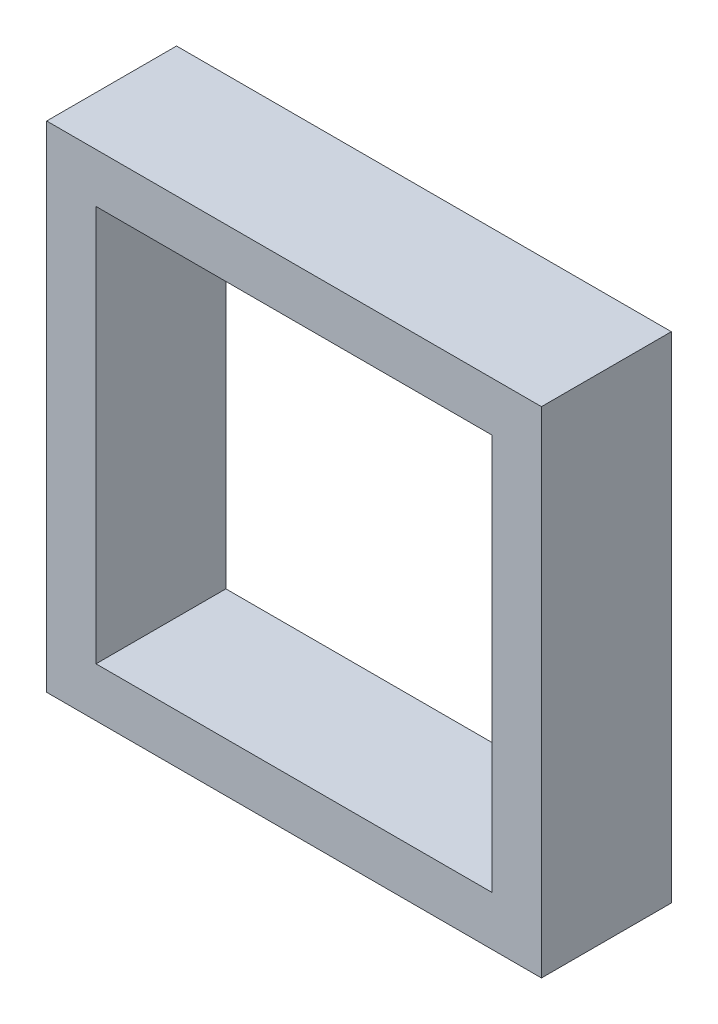
from build123d import *

# Parameters (mm, degrees)
ESQUISSE1_W        = 38.1
ESQUISSE1_H        = 38.1
ESQUISSE1_W_2      = 30.5
ESQUISSE1_H_2      = 30.5
BOSS_EXTRU_1_DEPTH = 10


with BuildPart() as part:
    # Esquisse1 → Boss.-Extru.1 (new body)
    with BuildSketch(Plane.XY):
        Rectangle(ESQUISSE1_W, ESQUISSE1_H)
        Rectangle(ESQUISSE1_W_2, ESQUISSE1_H_2, mode=Mode.SUBTRACT)
    extrude(amount=BOSS_EXTRU_1_DEPTH)


solid = part.part
